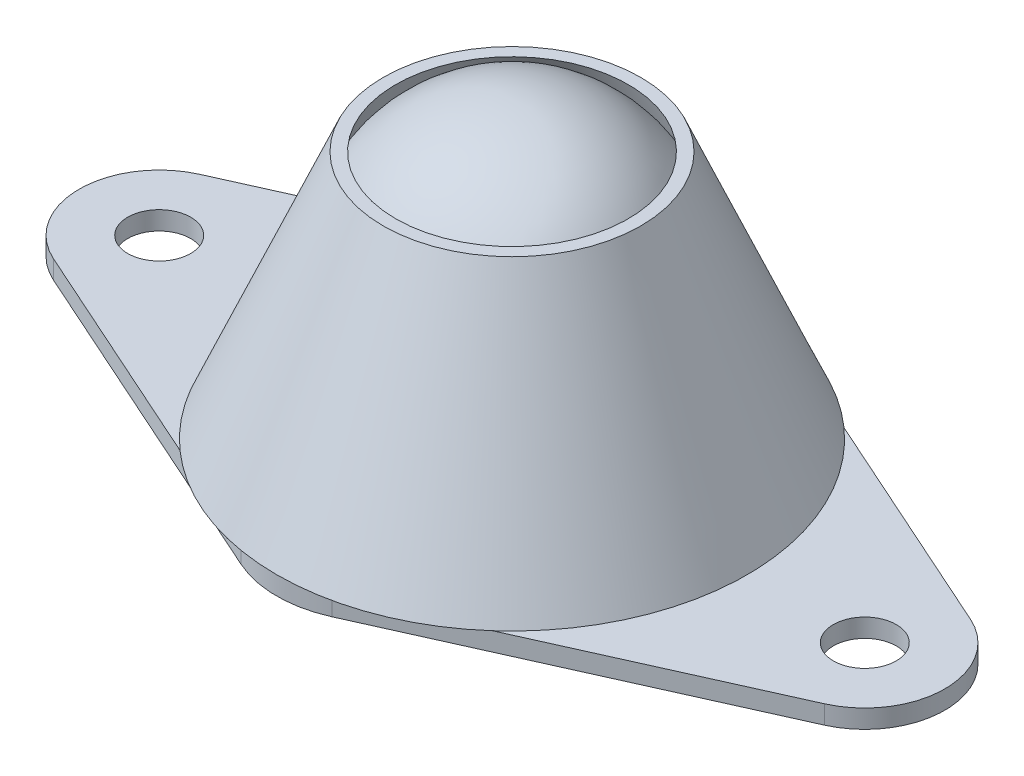
from build123d import *

# Parameters (mm, degrees)
BOSS_EXTRUDE1_DEPTH           = 1
SKETCH5_W                     = 1.7
SKETCH5_H                     = 16.875
M3_CLEARANCE_HOLE1_AT_2_COUNT = 2
M3_CLEARANCE_HOLE1_AT_2_PITCH = 38.1


with BuildPart() as part:
    # Sketch1 → Boss-Extrude1 (new body)
    with BuildSketch(Plane(origin=(0, 0, 0), x_dir=(1, 0, 0), z_dir=(0, 1, 0))):
        with BuildLine():
            Line((-20.817731489, 3.944572101), (-2.449202247, 12.176295775))
            ThreePointArc((-2.449202247, 12.176295775), (0, 12.7), (2.449202247, 12.176295775))
            Line((2.449202247, 12.176295775), (20.817731489, 3.944572101))
            ThreePointArc((20.817731489, 3.944572101), (23.372559853, 0), (20.817731489, -3.944572101))
            Line((20.817731489, -3.944572101), (2.449202247, -12.176295775))
            ThreePointArc((2.449202247, -12.176295775), (0, -12.7), (-2.449202247, -12.176295775))
            Line((-2.449202247, -12.176295775), (-20.817731489, -3.944572101))
            ThreePointArc((-20.817731489, -3.944572101), (-23.372559853, 0), (-20.817731489, 3.944572101))
        make_face()
    extrude(amount=BOSS_EXTRUDE1_DEPTH)

    # Sketch2 → Revolve3 (revolve)
    with BuildSketch(Plane.XY, mode=Mode.PRIVATE) as revolve3_sk:
        with BuildLine():
            ThreePointArc((0, 1), (7.9375, 8.9375), (0, 16.875))
            Line((0, 16.875), (0, 1))
        make_face()
        Polygon((9.258798991, 7.475034674), (6.280123217, 14.438436679), (6.951553228, 14.438436679), (12.7, 1), (3.60802322, 1), align=None)
    revolve(revolve3_sk.sketch.rotate(Axis((0, 16.875, 0), (0, -1, 0)), 90), axis=Axis((0, 16.875, 0), (0, -1, 0)))


with BuildPart() as revolve3_piece_1:
    # of the separate pieces the step leaves, piece 1, a body of its own (revolve3_pieces)
    add(part.part.solids().sort_by_distance((-2.449202247, 0, 12.176295775))[0])

    # Sketch5 → M3 Clearance Hole1 (revolve, cut)
    with BuildSketch(Plane(origin=(19.05, 0, 0), x_dir=(0, 0, -1), z_dir=(1, 0, 0))):
        with Locations((0.85, 8.4375)):
            Rectangle(SKETCH5_W, SKETCH5_H)
    m3_clearance_hole1 = revolve(axis=Axis((19.05, -6.35, 0), (0, 1, 0)), mode=Mode.SUBTRACT)

    # M3 Clearance Hole1 at 2: M3 Clearance Hole1 ×2
    with Locations(*[(-i * M3_CLEARANCE_HOLE1_AT_2_PITCH, 0, 0) for i in range(1, M3_CLEARANCE_HOLE1_AT_2_COUNT)]):
        add(m3_clearance_hole1, mode=Mode.SUBTRACT)


with BuildPart() as revolve3_piece_2:
    # of the separate pieces the step leaves, piece 2, a body of its own (revolve3_pieces)
    add(part.part.solids().sort_by_distance((0, 16.875, 0))[0])


solid = Compound([revolve3_piece_1.part, revolve3_piece_2.part])
